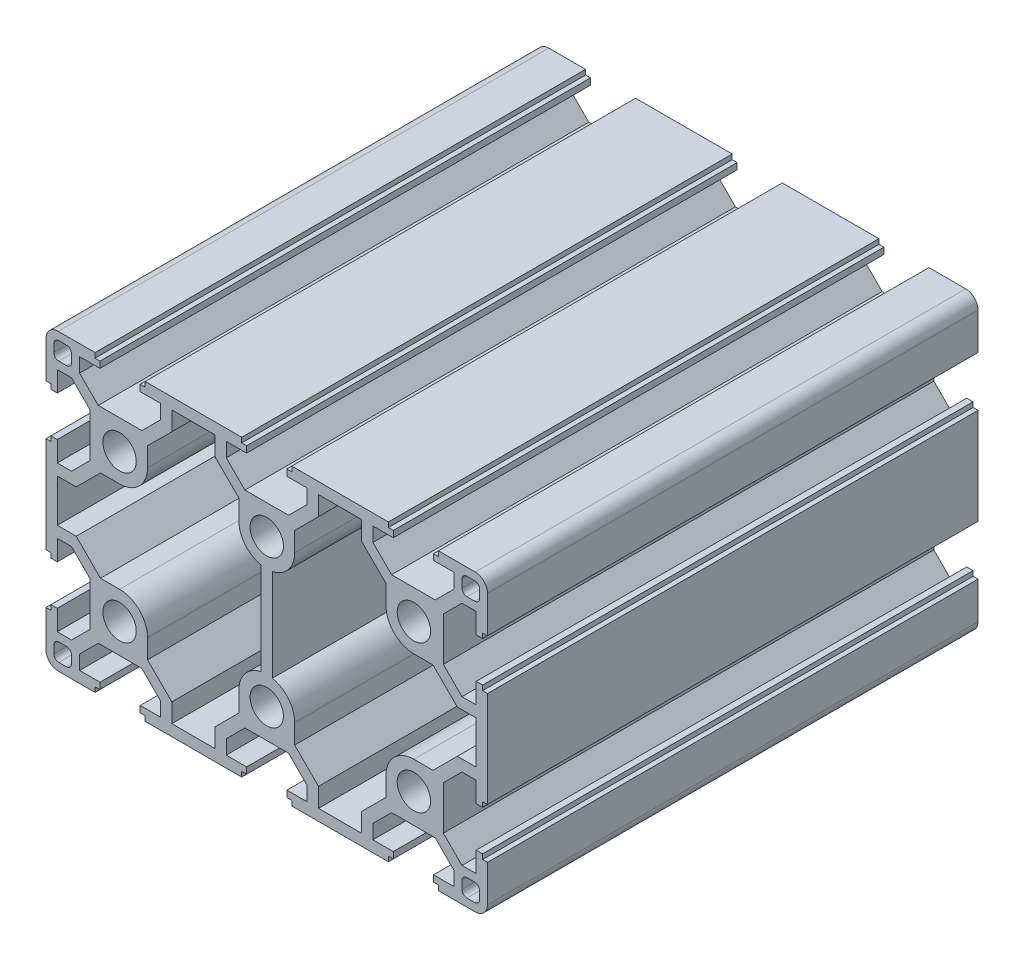
from build123d import *

# Parameters (mm, degrees)
SKETCH_1_R      = 3.4
EXTRUDE_1_DEPTH = 100


with BuildPart() as part:
    # 草图1 → 凸台-拉伸1 (new body)
    with BuildSketch(Plane.XY):
        with BuildLine():
            Line((-4.35, -36), (4.55, -36))
            Line((4.55, -36), (8.35, -39.8))
            Line((8.35, -39.8), (8.35, -42.7))
            Line((8.35, -42.7), (4.2, -42.7))
            Line((4.2, -42.7), (4.2, -44))
            Line((4.2, -44), (5.2, -44))
            Line((5.2, -44), (5.2, -45))
            Line((5.2, -45), (24.9, -45))
            Line((24.9, -45), (24.9, -44))
            Line((24.9, -44), (25.9, -44))
            Line((25.9, -44), (25.9, -42.7))
            Line((25.9, -42.7), (21.75, -42.7))
            Line((21.75, -42.7), (21.75, -39.8))
            Line((21.75, -39.8), (25.55, -36))
            Line((25.55, -36), (34.45, -36))
            Line((34.45, -36), (38.25, -39.8))
            Line((38.25, -39.8), (38.25, -42.7))
            Line((38.25, -42.7), (34.1, -42.7))
            Line((34.1, -42.7), (34.1, -44))
            Line((34.1, -44), (35.1, -44))
            Line((35.1, -44), (35.1, -45))
            Line((35.1, -45), (54.8, -45))
            Line((54.8, -45), (54.8, -44))
            Line((54.8, -44), (55.8, -44))
            Line((55.8, -44), (55.8, -42.7))
            Line((55.8, -42.7), (51.65, -42.7))
            Line((51.65, -42.7), (51.65, -39.8))
            Line((51.65, -39.8), (55.45, -36))
            Line((55.45, -36), (64.35, -36))
            Line((64.35, -36), (68.15, -39.8))
            Line((68.15, -39.8), (68.15, -42.7))
            Line((68.15, -42.7), (64, -42.7))
            Line((64, -42.7), (64, -44))
            Line((64, -44), (65, -44))
            Line((65, -44), (65, -45))
            Line((65, -45), (72.5, -45))
            ThreePointArc((72.5, -45), (74.267766953, -44.267766953), (75, -42.5))
            Line((75, -42.5), (75, -35))
            Line((75, -35), (74, -35))
            Line((74, -35), (74, -34))
            Line((74, -34), (72.7, -34))
            Line((72.7, -34), (72.7, -38.15))
            Line((72.7, -38.15), (69.8, -38.15))
            Line((69.8, -38.15), (66, -34.35))
            Line((66, -34.35), (66, -25.45))
            Line((66, -25.45), (69.8, -21.65))
            Line((69.8, -21.65), (72.7, -21.65))
            Line((72.7, -21.65), (72.7, -25.8))
            Line((72.7, -25.8), (74, -25.8))
            Line((74, -25.8), (74, -24.8))
            Line((74, -24.8), (75, -24.8))
            Line((75, -24.8), (75, -5.2))
            Line((75, -5.2), (74, -5.2))
            Line((74, -5.2), (74, -4.2))
            Line((74, -4.2), (72.7, -4.2))
            Line((72.7, -4.2), (72.7, -8.35))
            Line((72.7, -8.35), (69.8, -8.35))
            Line((69.8, -8.35), (66, -4.55))
            Line((66, -4.55), (66, 4.35))
            Line((66, 4.35), (69.8, 8.15))
            Line((69.8, 8.15), (72.7, 8.15))
            Line((72.7, 8.15), (72.7, 4))
            Line((72.7, 4), (74, 4))
            Line((74, 4), (74, 5))
            Line((74, 5), (75, 5))
            Line((75, 5), (75, 12.5))
            ThreePointArc((75, 12.5), (74.267766953, 14.267766953), (72.5, 15))
            Line((72.5, 15), (65, 15))
            Line((65, 15), (65, 14))
            Line((65, 14), (64, 14))
            Line((64, 14), (64, 12.8))
            Line((64, 12.8), (68.15, 12.8))
            Line((68.15, 12.8), (68.15, 9.8))
            Line((68.15, 9.8), (64.35, 6))
            Line((64.35, 6), (55.45, 6))
            Line((55.45, 6), (51.65, 9.8))
            Line((51.65, 9.8), (51.65, 12.7))
            Line((51.65, 12.7), (55.8, 12.7))
            Line((55.8, 12.7), (55.8, 14))
            Line((55.8, 14), (54.8, 14))
            Line((54.8, 14), (54.8, 15))
            Line((54.8, 15), (35.1, 15))
            Line((35.1, 15), (35.1, 14))
            Line((35.1, 14), (34.1, 14))
            Line((34.1, 14), (34.1, 12.7))
            Line((34.1, 12.7), (38.25, 12.7))
            Line((38.25, 12.7), (38.25, 9.8))
            Line((38.25, 9.8), (34.45, 6))
            Line((34.45, 6), (25.55, 6))
            Line((25.55, 6), (21.75, 9.8))
            Line((21.75, 9.8), (21.75, 12.7))
            Line((21.75, 12.7), (25.9, 12.7))
            Line((25.9, 12.7), (25.9, 14))
            Line((25.9, 14), (24.9, 14))
            Line((24.9, 14), (24.9, 15))
            Line((24.9, 15), (5.2, 15))
            Line((5.2, 15), (5.2, 14))
            Line((5.2, 14), (4.2, 14))
            Line((4.2, 14), (4.2, 12.7))
            Line((4.2, 12.7), (8.35, 12.7))
            Line((8.35, 12.7), (8.35, 9.8))
            Line((8.35, 9.8), (4.55, 6))
            Line((4.55, 6), (-4.35, 6))
            Line((-4.35, 6), (-8.15, 9.8))
            Line((-8.15, 9.8), (-8.15, 12.7))
            Line((-8.15, 12.7), (-4, 12.7))
            Line((-4, 12.7), (-4, 14))
            Line((-4, 14), (-5, 14))
            Line((-5, 14), (-5, 15))
            Line((-5, 15), (-12.5, 15))
            ThreePointArc((-12.5, 15), (-14.267766953, 14.267766953), (-15, 12.5))
            Line((-15, 12.5), (-15, 5))
            Line((-15, 5), (-14, 5))
            Line((-14, 5), (-14, 4))
            Line((-14, 4), (-12.7, 4))
            Line((-12.7, 4), (-12.7, 8.15))
            Line((-12.7, 8.15), (-9.8, 8.15))
            Line((-9.8, 8.15), (-6, 4.35))
            Line((-6, 4.35), (-6, -4.55))
            Line((-6, -4.55), (-9.8, -8.35))
            Line((-9.8, -8.35), (-12.7, -8.35))
            Line((-12.7, -8.35), (-12.7, -4.2))
            Line((-12.7, -4.2), (-14, -4.2))
            Line((-14, -4.2), (-14, -5.2))
            Line((-14, -5.2), (-15, -5.2))
            Line((-15, -5.2), (-15, -24.8))
            Line((-15, -24.8), (-14, -24.8))
            Line((-14, -24.8), (-14, -25.8))
            Line((-14, -25.8), (-12.7, -25.8))
            Line((-12.7, -25.8), (-12.7, -21.65))
            Line((-12.7, -21.65), (-9.8, -21.65))
            Line((-9.8, -21.65), (-6, -25.45))
            Line((-6, -25.45), (-6, -34.35))
            Line((-6, -34.35), (-9.8, -38.15))
            Line((-9.8, -38.15), (-12.7, -38.15))
            Line((-12.7, -38.15), (-12.7, -34))
            Line((-12.7, -34), (-14, -34))
            Line((-14, -34), (-14, -35))
            Line((-14, -35), (-15, -35))
            Line((-15, -35), (-15, -42.5))
            ThreePointArc((-15, -42.5), (-14.267766953, -44.267766953), (-12.5, -45))
            Line((-12.5, -45), (-5, -45))
            Line((-5, -45), (-5, -44))
            Line((-5, -44), (-4, -44))
            Line((-4, -44), (-4, -42.7))
            Line((-4, -42.7), (-8.15, -42.7))
            Line((-8.15, -42.7), (-8.15, -39.8))
            Line((-8.15, -39.8), (-4.35, -36))
        make_face()
        with Locations((0, -30)):
            Circle(SKETCH_1_R, mode=Mode.SUBTRACT)
        Circle(SKETCH_1_R, mode=Mode.SUBTRACT)
        with Locations((30, 0)):
            Circle(SKETCH_1_R, mode=Mode.SUBTRACT)
        with Locations((30, -30)):
            Circle(SKETCH_1_R, mode=Mode.SUBTRACT)
        with Locations((60, -30)):
            Circle(SKETCH_1_R, mode=Mode.SUBTRACT)
        with Locations((60, 0)):
            Circle(SKETCH_1_R, mode=Mode.SUBTRACT)
        with BuildLine():
            Line((-13.4, -42.4), (-13.4, -40.8))
            ThreePointArc((-13.4, -40.8), (-13.107106781, -40.092893219), (-12.4, -39.8))
            Line((-12.4, -39.8), (-10.8, -39.8))
            ThreePointArc((-10.8, -39.8), (-10.092893219, -40.092893219), (-9.8, -40.8))
            Line((-9.8, -40.8), (-9.8, -42.4))
            ThreePointArc((-9.8, -42.4), (-10.092893219, -43.107106781), (-10.8, -43.4))
            Line((-10.8, -43.4), (-12.4, -43.4))
            ThreePointArc((-12.4, -43.4), (-13.107106781, -43.107106781), (-13.4, -42.4))
        make_face(mode=Mode.SUBTRACT)
        with BuildLine():
            Line((-12.4, 13.4), (-10.8, 13.4))
            ThreePointArc((-10.8, 13.4), (-10.092893219, 13.107106781), (-9.8, 12.4))
            Line((-9.8, 12.4), (-9.8, 10.8))
            ThreePointArc((-9.8, 10.8), (-10.092893219, 10.092893219), (-10.8, 9.8))
            Line((-10.8, 9.8), (-12.4, 9.8))
            ThreePointArc((-12.4, 9.8), (-13.107106781, 10.092893219), (-13.4, 10.8))
            Line((-13.4, 10.8), (-13.4, 12.4))
            ThreePointArc((-13.4, 12.4), (-13.107106781, 13.107106781), (-12.4, 13.4))
        make_face(mode=Mode.SUBTRACT)
        with BuildLine():
            Line((24.3, 3.997308807), (24.3, 0))
            ThreePointArc((24.3, 0), (25.581572678, -3.601041516), (28.85, -5.582786043))
            Line((28.85, -5.582786043), (28.85, -24.417213957))
            ThreePointArc((28.85, -24.417213957), (25.581572678, -26.398958484), (24.3, -30))
            Line((24.3, -30), (24.3, -33.997308807))
            Line((24.3, -33.997308807), (19.45, -38.847308807))
            Line((19.45, -38.847308807), (19.45, -42.7))
            Line((19.45, -42.7), (10.65, -42.7))
            Line((10.65, -42.7), (10.65, -38.847308807))
            Line((10.65, -38.847308807), (5.7, -33.897308807))
            Line((5.7, -33.897308807), (5.7, -30))
            ThreePointArc((5.7, -30), (4.030508653, -25.969491347), (0, -24.3))
            Line((0, -24.3), (-3.897308807, -24.3))
            Line((-3.897308807, -24.3), (-8.847308807, -19.35))
            Line((-8.847308807, -19.35), (-12.7, -19.35))
            Line((-12.7, -19.35), (-12.7, -10.65))
            Line((-12.7, -10.65), (-8.847308807, -10.65))
            Line((-8.847308807, -10.65), (-3.897308807, -5.7))
            Line((-3.897308807, -5.7), (0, -5.7))
            ThreePointArc((0, -5.7), (4.030508653, -4.030508653), (5.7, 0))
            Line((5.7, 0), (5.7, 3.897308807))
            Line((5.7, 3.897308807), (10.65, 8.847308807))
            Line((10.65, 8.847308807), (10.65, 12.7))
            Line((10.65, 12.7), (19.45, 12.7))
            Line((19.45, 12.7), (19.45, 8.847308807))
            Line((19.45, 8.847308807), (24.3, 3.997308807))
        make_face(mode=Mode.SUBTRACT)
        with BuildLine():
            Line((72.4, -43.4), (70.8, -43.4))
            ThreePointArc((70.8, -43.4), (70.092893219, -43.107106781), (69.8, -42.4))
            Line((69.8, -42.4), (69.8, -40.8))
            ThreePointArc((69.8, -40.8), (70.092893219, -40.092893219), (70.8, -39.8))
            Line((70.8, -39.8), (72.4, -39.8))
            ThreePointArc((72.4, -39.8), (73.107106781, -40.092893219), (73.4, -40.8))
            Line((73.4, -40.8), (73.4, -42.4))
            ThreePointArc((73.4, -42.4), (73.107106781, -43.107106781), (72.4, -43.4))
        make_face(mode=Mode.SUBTRACT)
        with BuildLine():
            Line((72.7, -10.65), (72.7, -19.35))
            Line((72.7, -19.35), (68.847308807, -19.35))
            Line((68.847308807, -19.35), (63.897308807, -24.3))
            Line((63.897308807, -24.3), (60, -24.3))
            ThreePointArc((60, -24.3), (55.969491347, -25.969491347), (54.3, -30))
            Line((54.3, -30), (54.3, -33.897308807))
            Line((54.3, -33.897308807), (49.35, -38.847308807))
            Line((49.35, -38.847308807), (49.35, -42.7))
            Line((49.35, -42.7), (40.55, -42.7))
            Line((40.55, -42.7), (40.55, -38.8))
            Line((40.55, -38.8), (35.7, -33.95))
            Line((35.7, -33.95), (35.7, -30))
            ThreePointArc((35.7, -30), (34.418427322, -26.398958484), (31.15, -24.417213957))
            Line((31.15, -24.417213957), (31.15, -5.582786043))
            ThreePointArc((31.15, -5.582786043), (34.418427322, -3.601041516), (35.7, 0))
            Line((35.7, 0), (35.7, 3.95))
            Line((35.7, 3.95), (40.55, 8.8))
            Line((40.55, 8.8), (40.55, 12.7))
            Line((40.55, 12.7), (49.35, 12.7))
            Line((49.35, 12.7), (49.35, 8.847308807))
            Line((49.35, 8.847308807), (54.3, 3.897308807))
            Line((54.3, 3.897308807), (54.3, 0))
            ThreePointArc((54.3, 0), (55.969491347, -4.030508653), (60, -5.7))
            Line((60, -5.7), (63.897308807, -5.7))
            Line((63.897308807, -5.7), (68.847308807, -10.65))
            Line((68.847308807, -10.65), (72.7, -10.65))
        make_face(mode=Mode.SUBTRACT)
        with BuildLine():
            Line((73.4, 12.4), (73.4, 10.8))
            ThreePointArc((73.4, 10.8), (73.107106781, 10.092893219), (72.4, 9.8))
            Line((72.4, 9.8), (70.8, 9.8))
            ThreePointArc((70.8, 9.8), (70.092893219, 10.092893219), (69.8, 10.8))
            Line((69.8, 10.8), (69.8, 12.4))
            ThreePointArc((69.8, 12.4), (70.092893219, 13.107106781), (70.8, 13.4))
            Line((70.8, 13.4), (72.4, 13.4))
            ThreePointArc((72.4, 13.4), (73.107106781, 13.107106781), (73.4, 12.4))
        make_face(mode=Mode.SUBTRACT)
    extrude(amount=EXTRUDE_1_DEPTH)


solid = part.part
